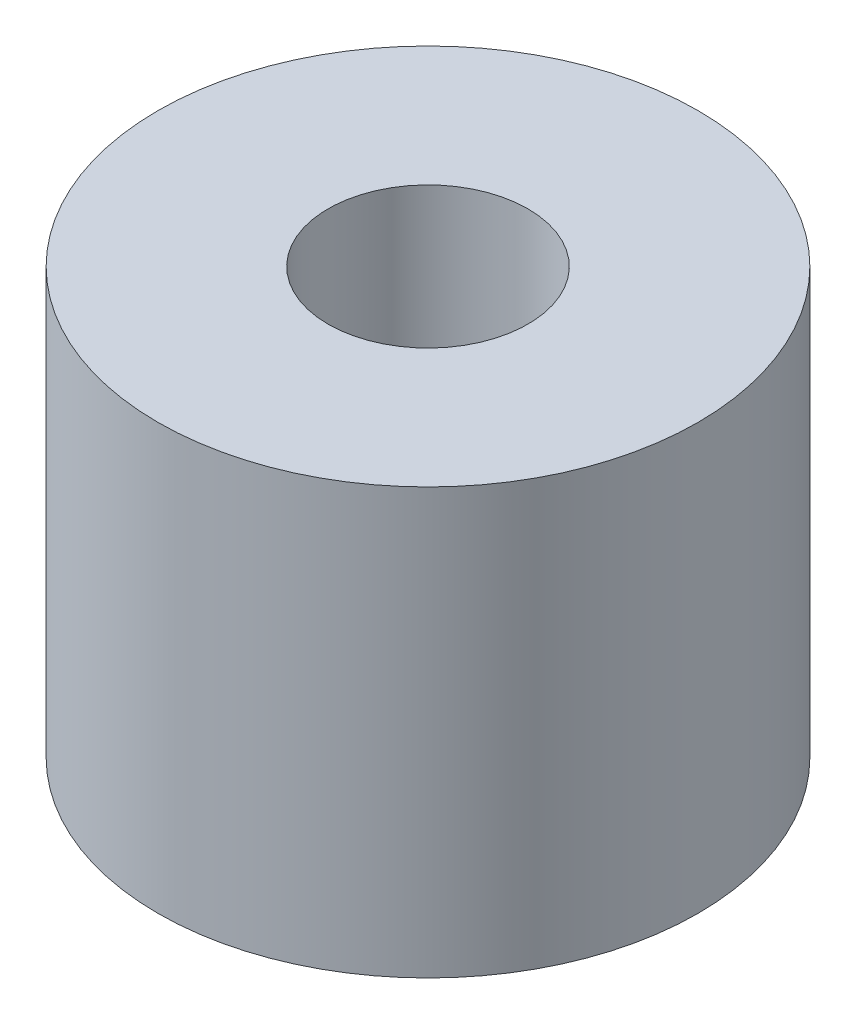
from build123d import *

# Parameters (mm, degrees)
SKETCH1_R           = 3.175
SKETCH1_R_2         = 1.175
BOSS_EXTRUDE1_DEPTH = 5


with BuildPart() as part:
    # Sketch1 → Boss-Extrude1 (new body)
    with BuildSketch(Plane(origin=(0, 0, 0), x_dir=(1, 0, 0), z_dir=(0, 1, 0))):
        with Locations(Location((0, 0, 0), (0, 0, 270))):
            Circle(SKETCH1_R)
        with Locations(Location((0, 0, 0), (0, 0, 270))):
            Circle(SKETCH1_R_2, mode=Mode.SUBTRACT)
    extrude(amount=BOSS_EXTRUDE1_DEPTH)


solid = part.part
